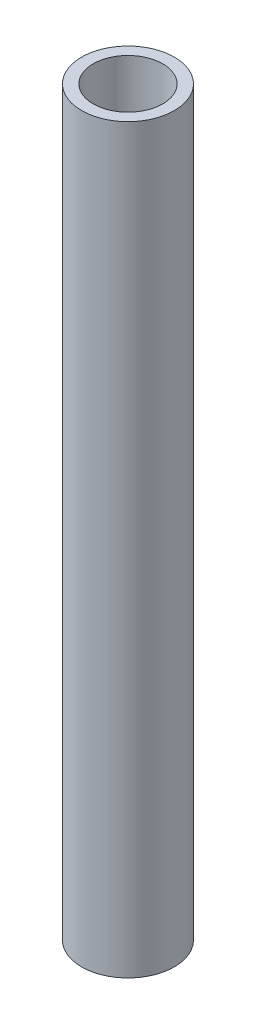
from build123d import *

# Parameters (mm, degrees)
SKETCH1_R                      = 3.175
SKETCH1_R_2                    = 2.38125
BOSS_EXTRUDE1_DEPTH            = 50.8
F_1_8_0_1250_DOWEL_HOLE1_D     = 3.175
F_1_8_0_1250_DOWEL_HOLE1_DEPTH = 3.18
F_1_8_0_1250_DOWEL_HOLE1_TIP   = 0.953866233


with BuildPart() as part:
    # Sketch1 → Boss-Extrude1 (new body)
    with BuildSketch(Plane(origin=(0, 0, 0), x_dir=(1, 0, 0), z_dir=(0, 1, 0))):
        with Locations(Location((0, 0, 0), (0, 0, 270))):
            Circle(SKETCH1_R)
        with Locations(Location((0, 0, 0), (0, 0, 270))):
            Circle(SKETCH1_R_2, mode=Mode.SUBTRACT)
    extrude(amount=BOSS_EXTRUDE1_DEPTH)

    # 1/8 (0.1250) Dowel Hole1
    with Locations(Plane(origin=(-3.174999594, 3.17502462, 0.001605192), x_dir=(-0.000505572354, 0, -0.999999872198), z_dir=(-0.999999872198, 0, 0.000505572354))):
        with Locations((0, 0)):
            Hole(F_1_8_0_1250_DOWEL_HOLE1_D / 2, depth=F_1_8_0_1250_DOWEL_HOLE1_DEPTH)
            with Locations((0, 0, -(F_1_8_0_1250_DOWEL_HOLE1_DEPTH + F_1_8_0_1250_DOWEL_HOLE1_TIP / 2))):  # 118° drill point
                Cone(0, F_1_8_0_1250_DOWEL_HOLE1_D / 2, F_1_8_0_1250_DOWEL_HOLE1_TIP, mode=Mode.SUBTRACT)


solid = part.part
